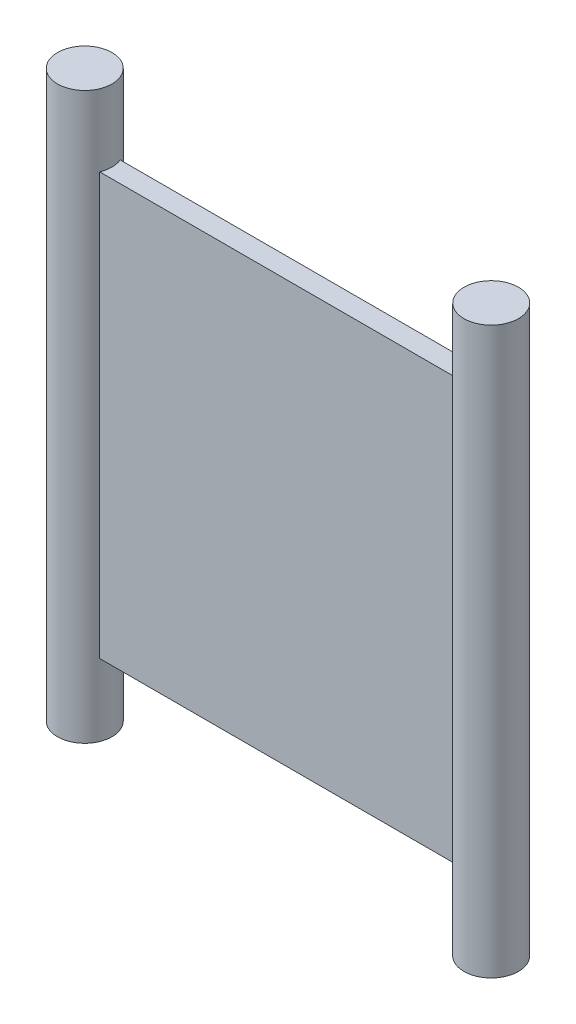
from build123d import *

# Parameters (mm, degrees)
SKETCH1_W           = 19.77
SKETCH1_H           = 1
BOSS_EXTRUDE1_DEPTH = 20.5
SKETCH2_R           = 1.325
BOSS_EXTRUDE2_DEPTH = 13.75


with BuildPart() as part:
    # Sketch1 → Boss-Extrude1 (new body)
    with BuildSketch(Plane(origin=(0, 0, 0), x_dir=(1, 0, 0), z_dir=(0, 1, 0))):
        Rectangle(SKETCH1_W, SKETCH1_H)
    extrude(amount=BOSS_EXTRUDE1_DEPTH)

    # Sketch2 → Boss-Extrude2 (add, symmetric)
    with BuildSketch(Plane(origin=(0, 10.25, 0), x_dir=(1, 0, 0), z_dir=(0, 1, 0))):
        with Locations(Location((-9.885, 0, 0), (0, 0, 270))):
            Circle(SKETCH2_R)
        with Locations(Location((9.885, 0, 0), (0, 0, 270))):
            Circle(SKETCH2_R)
    extrude(amount=BOSS_EXTRUDE2_DEPTH, both=True)


solid = part.part
